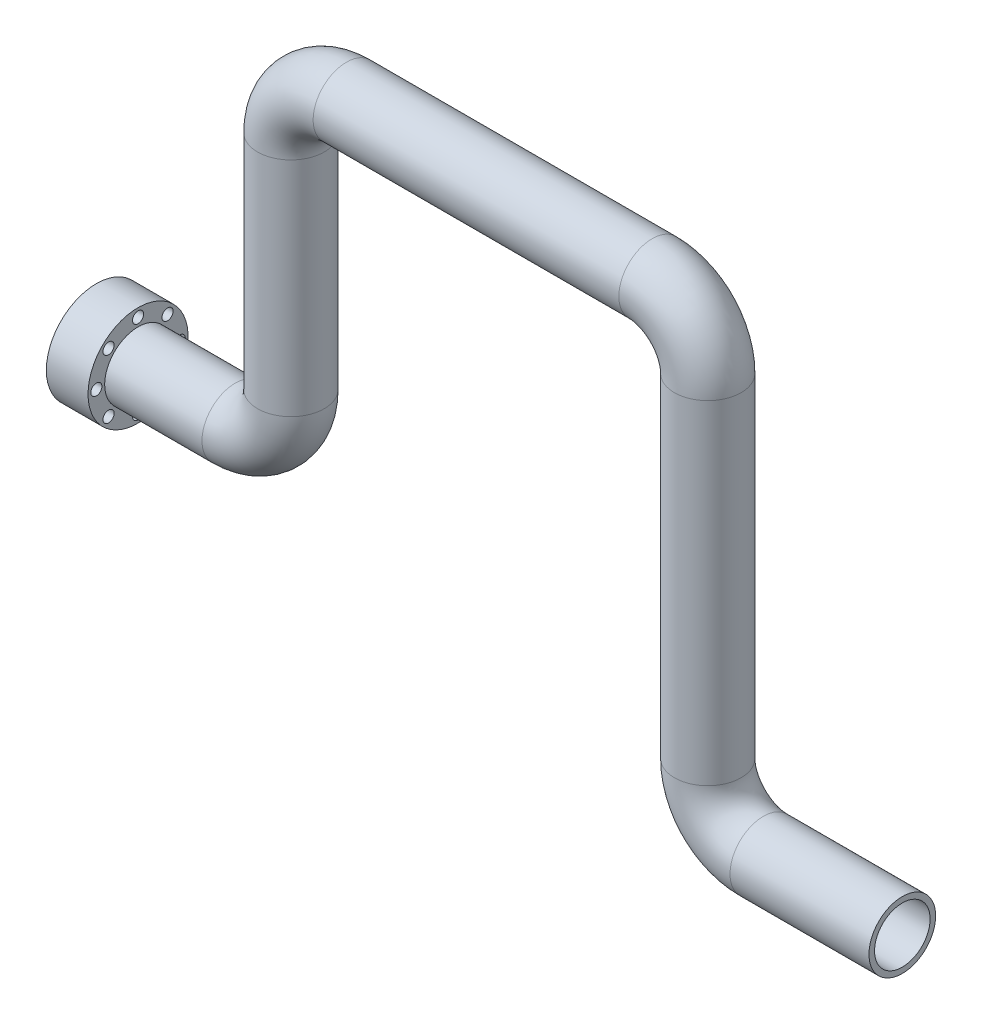
from build123d import *

# Parameters (mm, degrees)
SKETCH2_R           = 6
SKETCH2_R_2         = 5
SKETCH3_R           = 9
SKETCH3_R_2         = 6
BOSS_EXTRUDE1_DEPTH = 7.5
SKETCH4_R           = 1
CUT_EXTRUDE1_DEPTH  = 10


with BuildPart() as part:
    # Sweep1: sweep along a path in Sketch1
    with BuildLine(Plane.XY) as sweep1_path:
        Line((0, 0), (25, 0))
        ThreePointArc((25, 0), (32.071067812, 2.928932188), (35, 10))
        Line((35, 10), (35, 50))
        ThreePointArc((35, 50), (37.928932188, 57.071067812), (45, 60))
        Line((45, 60), (100, 60))
        ThreePointArc((100, 60), (107.071067812, 57.071067812), (110, 50))
        Line((110, 50), (110, -10))
        ThreePointArc((110, -10), (112.928932188, -17.071067812), (120, -20))
        Line((120, -20), (145, -20))
    # Sketch2 → Sweep1 (sweep)
    with BuildSketch(Plane(origin=(0, 0, 0), x_dir=(0, 0, -1), z_dir=(1, 0, 0))):
        Circle(SKETCH2_R)
        Circle(SKETCH2_R_2, mode=Mode.SUBTRACT)
    sweep(path=sweep1_path.line)


with BuildPart() as body_2:
    # Sketch3 → Boss-Extrude1 (new body)
    with BuildSketch(Plane.ZY):
        Circle(SKETCH3_R)
        Circle(SKETCH3_R_2, mode=Mode.SUBTRACT)
    extrude(amount=-BOSS_EXTRUDE1_DEPTH)

    # Sketch4 → Cut-Extrude1 (cut)
    with BuildSketch(Plane.ZY):
        with Locations((0, 7.5)):
            Circle(SKETCH4_R)
        with Locations((5.303300859, 5.303300859)):
            Circle(SKETCH4_R)
        with Locations((7.5, 0)):
            Circle(SKETCH4_R)
        with Locations((5.303300859, -5.303300859)):
            Circle(SKETCH4_R)
        with Locations((0, -7.5)):
            Circle(SKETCH4_R)
        with Locations((-5.303300859, -5.303300859)):
            Circle(SKETCH4_R)
        with Locations((-7.5, 0)):
            Circle(SKETCH4_R)
        with Locations((-5.303300859, 5.303300859)):
            Circle(SKETCH4_R)
    extrude(amount=-CUT_EXTRUDE1_DEPTH, mode=Mode.SUBTRACT)


solid = Compound([part.part, body_2.part])
